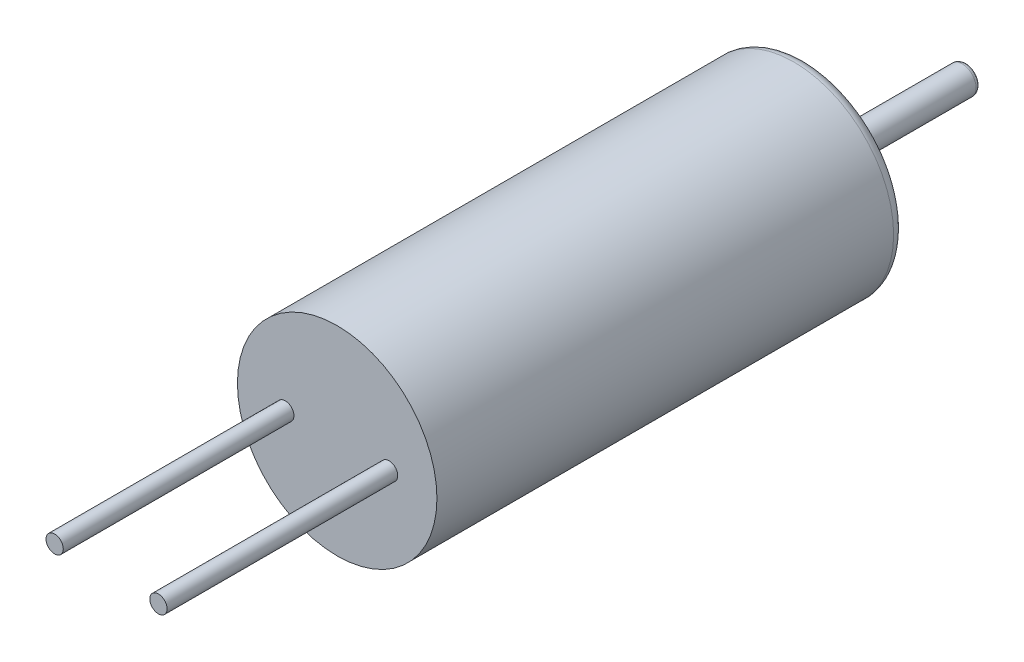
from build123d import *

# Parameters (mm, degrees)
FILLET1_R           = 0.5
FILLET2_R           = 0.2
SKETCH2_R           = 0.375
BOSS_EXTRUDE1_DEPTH = 10


with BuildPart() as part:
    # Sketch1 → Revolve1 (revolve)
    with BuildSketch(Plane(origin=(0, 0, 0), x_dir=(1, 0, 0), z_dir=(0, 1, 0))):
        Polygon((4.325, 20.3), (4.325, 0), (0, 0), (0, 27.3), (0.6, 27.3), (0.6, 21.1), (1.2, 21.1), (1.2, 20.3), align=None)
    revolve(axis=Axis((0, 0, 0), (0, 0, -1)))

    # Fillet1
    fillet1_edges = [part.edges().sort_by_distance(p)[0] for p in [
        (-4.325, 0, -20.3),
    ]]
    fillet(fillet1_edges, radius=FILLET1_R)

    # Fillet2
    fillet2_edges = [part.edges().sort_by_distance(p)[0] for p in [
        (-1.2, 0, -21.1),
        (-0.6, 0, -27.3),
    ]]
    fillet(fillet2_edges, radius=FILLET2_R)

    # Sketch2 → Boss-Extrude1 (add)
    with BuildSketch(Plane.XY):
        with Locations((-2.25, 0)):
            Circle(SKETCH2_R)
        with Locations(Location((2.25, 0, 0), (0, 0, 180))):
            Circle(SKETCH2_R)
    extrude(amount=BOSS_EXTRUDE1_DEPTH)


solid = part.part
